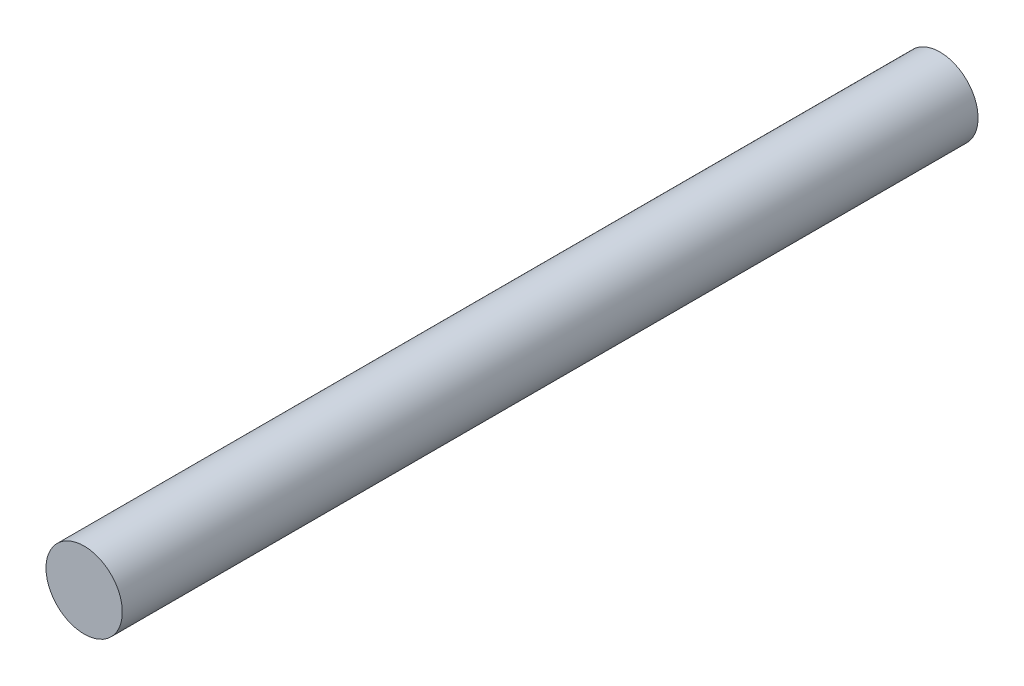
from build123d import *

# Parameters (mm, degrees)
SKETCH1_R           = 2.5908
BOSS_EXTRUDE1_DEPTH = 58.1


with BuildPart() as part:
    # Sketch1 → Boss-Extrude1 (new body)
    with BuildSketch(Plane.XY):
        with Locations(Location((0, 0, 0), (0, 0, 180))):
            Circle(SKETCH1_R)
    extrude(amount=BOSS_EXTRUDE1_DEPTH)


solid = part.part
